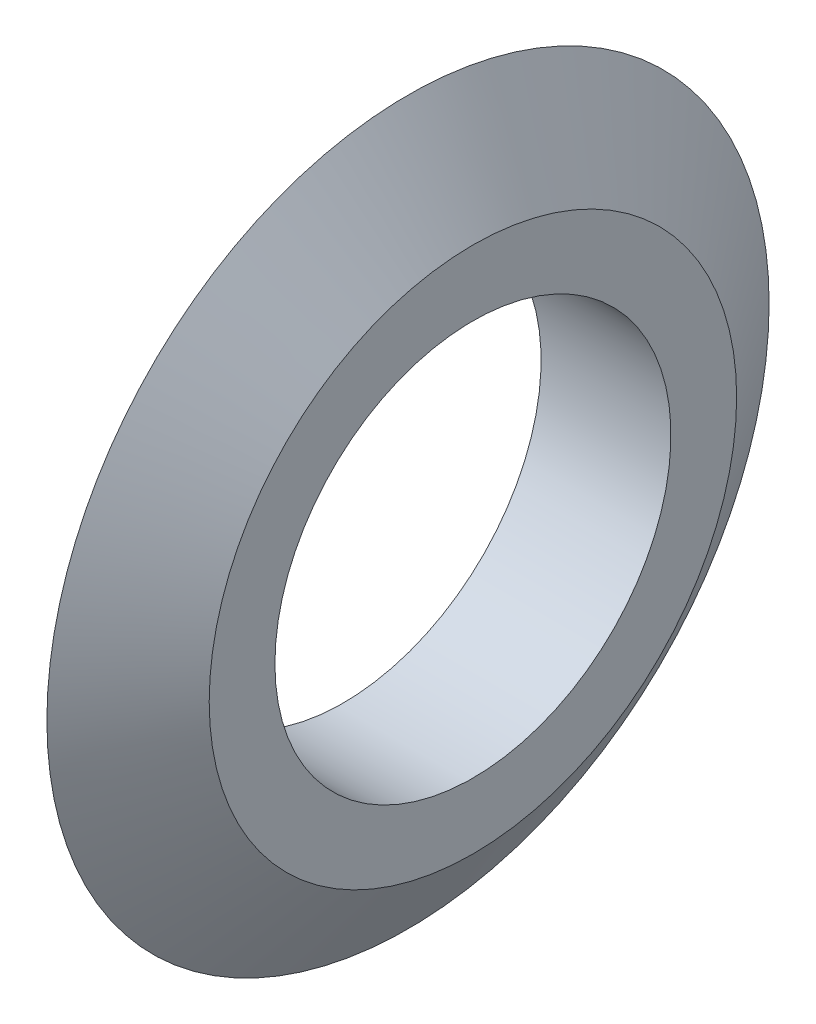
from build123d import *


with BuildPart() as part:
    # Sketch5 → Revolve4 (revolve)
    with BuildSketch(Plane.XY, mode=Mode.PRIVATE) as revolve4_sk:
        Polygon((-2, 6.1), (2, 6.1), (2, 8.124358323), (0, 11.124358323), (-2, 8.124358323), align=None)
    revolve(revolve4_sk.sketch.rotate(Axis((-6.924078091, 0, 0), (1, 0, 0)), 90), axis=Axis((-6.924078091, 0, 0), (1, 0, 0)))


solid = part.part
